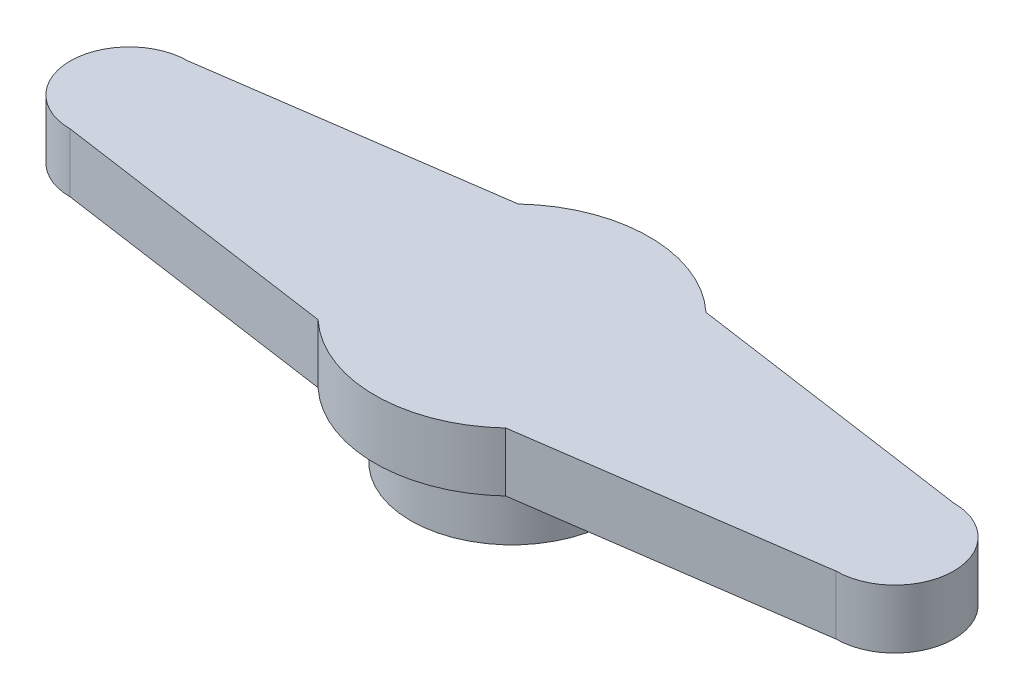
from build123d import *

# Parameters (mm, degrees)
BOSS_EXTRUDE1_DEPTH = 2.54
SKETCH2_R           = 4.3688
BOSS_EXTRUDE2_DEPTH = 2.921


with BuildPart() as part:
    # Sketch1 → Boss-Extrude1 (new body)
    with BuildSketch(Plane(origin=(0, 0, 0), x_dir=(1, 0, 0), z_dir=(0, 1, 0))):
        with BuildLine():
            Line((4.047217222, 4.318), (16.51, 2.54))
            ThreePointArc((16.51, 2.54), (19.05, 0), (16.51, -2.54))
            Line((16.51, -2.54), (4.047217222, -4.318))
            ThreePointArc((4.047217222, -4.318), (0, -5.9182), (-4.047217222, -4.318))
            Line((-4.047217222, -4.318), (-16.51, -2.54))
            ThreePointArc((-16.51, -2.54), (-19.05, 0), (-16.51, 2.54))
            Line((-16.51, 2.54), (-4.047217222, 4.318))
            ThreePointArc((-4.047217222, 4.318), (0, 5.9182), (4.047217222, 4.318))
        make_face()
    extrude(amount=BOSS_EXTRUDE1_DEPTH)

    # Sketch2 → Boss-Extrude2 (add)
    with BuildSketch(Plane.XZ):
        with Locations(Location((0, 0, 0), (0, 0, 270))):
            Circle(SKETCH2_R)
    extrude(amount=BOSS_EXTRUDE2_DEPTH)


solid = part.part
